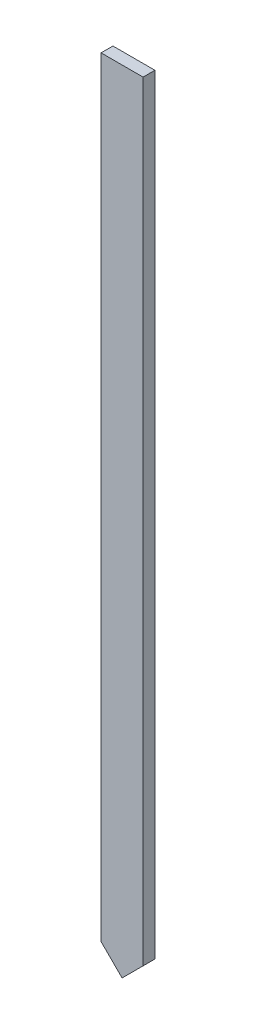
from build123d import *

# Parameters (mm, degrees)
BOSS_EXTRUDE1_DEPTH = 2


with BuildPart() as part:
    # Sketch1 → Boss-Extrude1 (new body)
    with BuildSketch(Plane.XY):
        Polygon((-3.129762973, -22.586960514), (0.415237027, -19.041960514), (0.415237027, 110.913039486), (-6.674762973, 110.913039486), (-6.674762973, -19.041960514), align=None)
    extrude(amount=BOSS_EXTRUDE1_DEPTH)


solid = part.part
